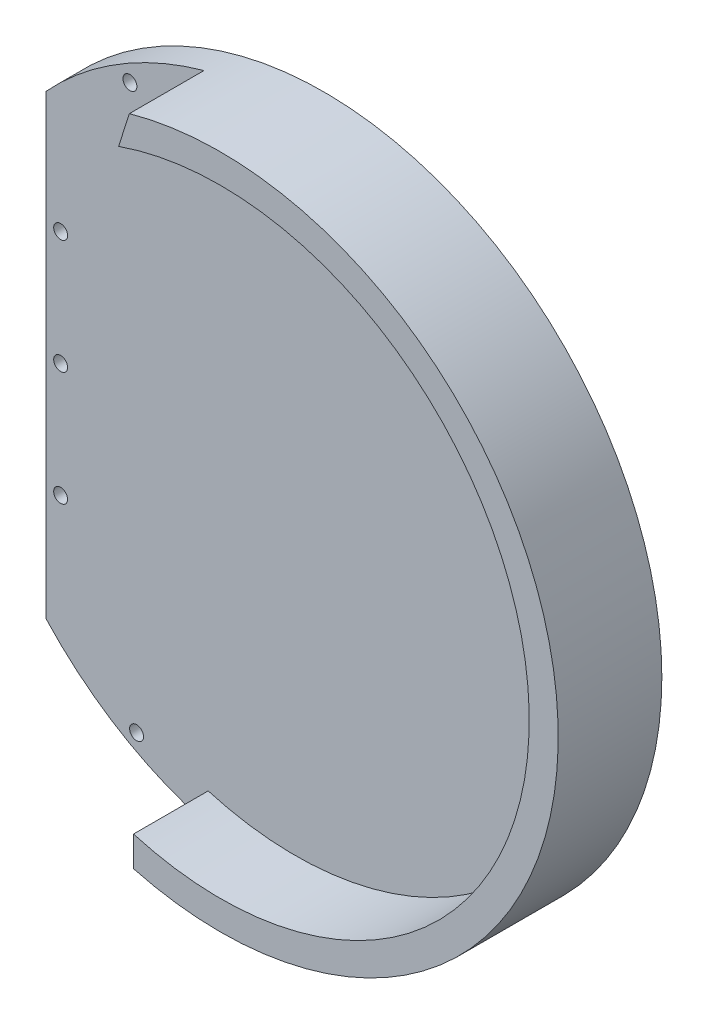
from build123d import *

# Parameters (mm, degrees)
BOSS_EXTRUDE1_DEPTH = 5
SKETCH2_R           = 1.2
CUT_EXTRUDE1_DEPTH  = 117.909745524
BOSS_EXTRUDE2_DEPTH = 12.879


with BuildPart() as part:
    # Sketch1 → Boss-Extrude1 (new body)
    with BuildSketch(Plane.XY):
        with BuildLine():
            Line((0, -39.4175), (0, 39.4175))
            ThreePointArc((0, 39.4175), (101.221, 0), (0, -39.4175))
        make_face()
    extrude(amount=BOSS_EXTRUDE1_DEPTH)

    # Sketch2 → Cut-Extrude1 (cut, through all)
    with BuildSketch(Plane.XY.offset(5)):
        with Locations((2.5, 19.70875)):
            Circle(SKETCH2_R)
        with Locations((2.5, 0)):
            Circle(SKETCH2_R)
        with Locations((2.5, -19.70875)):
            Circle(SKETCH2_R)
        with Locations((14.450382973, 47.941684776)):
            Circle(SKETCH2_R)
        with Locations((15.603067001, -48.610455862)):
            Circle(SKETCH2_R)
    extrude(amount=-CUT_EXTRUDE1_DEPTH, mode=Mode.SUBTRACT)

    # Sketch3 → Boss-Extrude2 (add)
    with BuildSketch(Plane.XY.offset(5)):
        with BuildLine():
            Line((27.955, -56.327452693), (27.955, -51.136357684))
            ThreePointArc((27.955, -51.136357684), (96.203818326, 1.353060418), (25.378179175, 50.30986847))
            Line((25.378179175, 50.30986847), (27.236614528, 56.131473172))
            ThreePointArc((27.236614528, 56.131473172), (101.219810829, 0.372318969), (27.955, -56.327452693))
        make_face()
    extrude(amount=BOSS_EXTRUDE2_DEPTH)


solid = part.part
